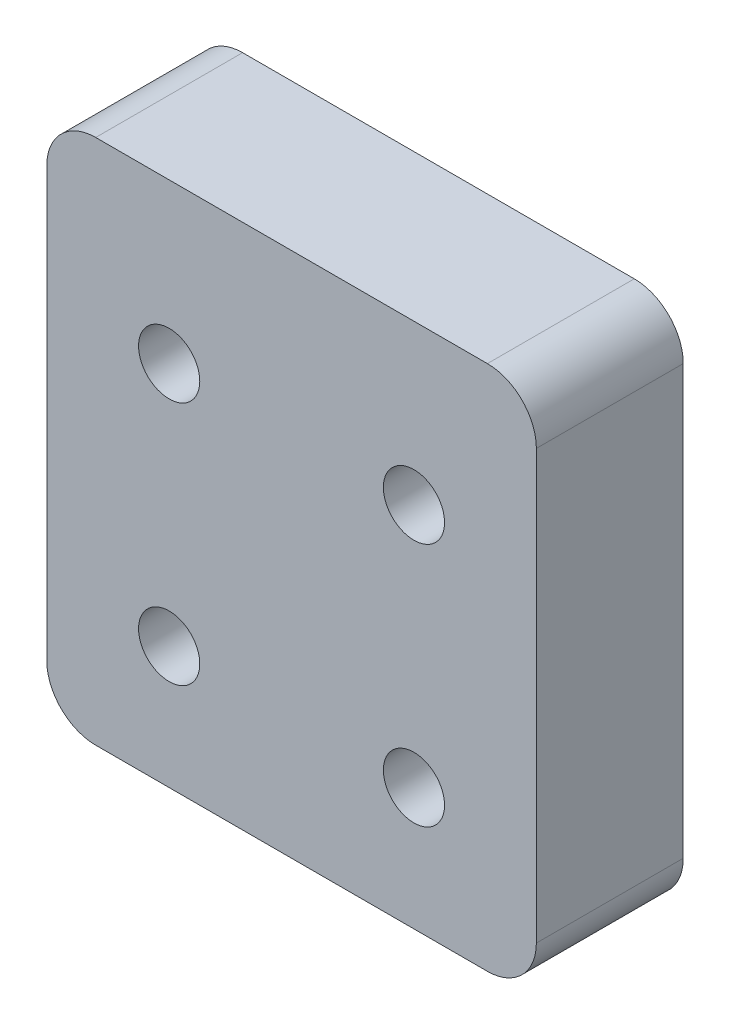
from build123d import *

# Parameters (mm, degrees)
ESQUISSE1_W             = 40
ESQUISSE1_H             = 43
BOSS_EXTRU_1_DEPTH      = 12
ESQUISSE2_R             = 2.5
ENL_V_MAT_EXTRU_1_DEPTH = 60.941638283
CONG_1_R                = 4


with BuildPart() as part:
    # Esquisse1 → Boss.-Extru.1 (new body)
    with BuildSketch(Plane.XY):
        with Locations((20, 21.5)):
            Rectangle(ESQUISSE1_W, ESQUISSE1_H)
    extrude(amount=BOSS_EXTRU_1_DEPTH)

    # Esquisse2 → Enlèv. mat.-Extru.1 (cut, through all)
    with BuildSketch(Plane.XY.offset(12)):
        with Locations((10, 30)):
            Circle(ESQUISSE2_R)
        with Locations(Location((10, 10, 0), (0, 0, 180))):
            Circle(ESQUISSE2_R)
        with Locations((30, 10)):
            Circle(ESQUISSE2_R)
        with Locations(Location((30, 30, 0), (0, 0, 180))):
            Circle(ESQUISSE2_R)
    extrude(amount=-ENL_V_MAT_EXTRU_1_DEPTH, mode=Mode.SUBTRACT)

    # Congé1
    cong_1_edges = [part.edges().sort_by_distance(p)[0] for p in [
        (0, 43, 6),
        (40, 43, 6),
        (40, 0, 6),
        (0, 0, 6),
    ]]
    fillet(cong_1_edges, radius=CONG_1_R)


solid = part.part
